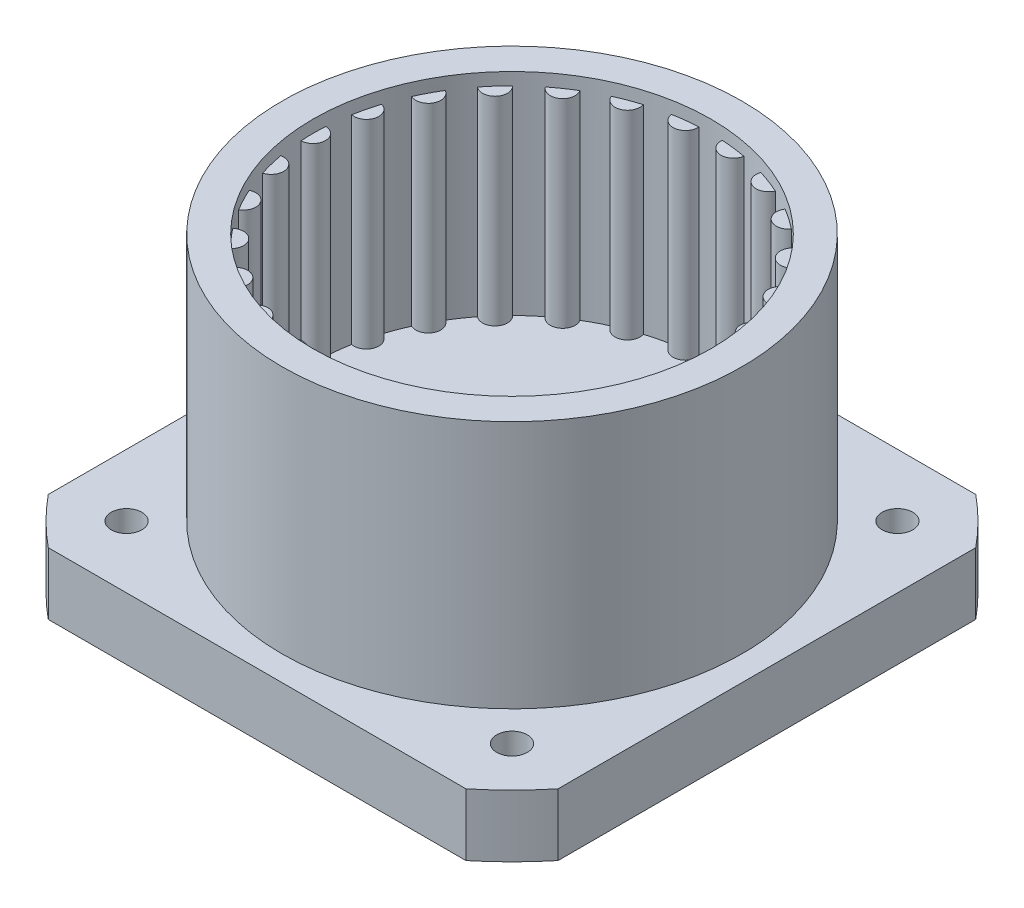
from build123d import *

# Parameters (mm, degrees)
BOSS_EXTRUDE1_DEPTH         = 8
BOSS_EXTRUDE1_DEPTH_BACK    = 8
SKETCH2_R                   = 1
BOSS_EXTRUDE1_2_DEPTH       = 8
BOSS_EXTRUDE1_2_DEPTH_BACK  = 8
BOSS_EXTRUDE1_3_DEPTH       = 8
BOSS_EXTRUDE1_3_DEPTH_BACK  = 8
BOSS_EXTRUDE1_4_DEPTH       = 8
BOSS_EXTRUDE1_4_DEPTH_BACK  = 8
BOSS_EXTRUDE1_5_DEPTH       = 8
BOSS_EXTRUDE1_5_DEPTH_BACK  = 8
BOSS_EXTRUDE1_6_DEPTH       = 8
BOSS_EXTRUDE1_6_DEPTH_BACK  = 8
BOSS_EXTRUDE1_7_DEPTH       = 8
BOSS_EXTRUDE1_7_DEPTH_BACK  = 8
BOSS_EXTRUDE1_8_DEPTH       = 8
BOSS_EXTRUDE1_8_DEPTH_BACK  = 8
BOSS_EXTRUDE1_9_DEPTH       = 8
BOSS_EXTRUDE1_9_DEPTH_BACK  = 8
BOSS_EXTRUDE1_10_DEPTH      = 8
BOSS_EXTRUDE1_10_DEPTH_BACK = 8
BOSS_EXTRUDE1_11_DEPTH      = 8
BOSS_EXTRUDE1_11_DEPTH_BACK = 8
BOSS_EXTRUDE1_12_DEPTH      = 8
BOSS_EXTRUDE1_12_DEPTH_BACK = 8
BOSS_EXTRUDE1_13_DEPTH      = 8
BOSS_EXTRUDE1_13_DEPTH_BACK = 8
BOSS_EXTRUDE1_14_DEPTH      = 8
BOSS_EXTRUDE1_14_DEPTH_BACK = 8
BOSS_EXTRUDE1_15_DEPTH      = 8
BOSS_EXTRUDE1_15_DEPTH_BACK = 8
BOSS_EXTRUDE1_16_DEPTH      = 8
BOSS_EXTRUDE1_16_DEPTH_BACK = 8
BOSS_EXTRUDE1_17_DEPTH      = 8
BOSS_EXTRUDE1_17_DEPTH_BACK = 8
BOSS_EXTRUDE1_18_DEPTH      = 8
BOSS_EXTRUDE1_18_DEPTH_BACK = 8
BOSS_EXTRUDE1_19_DEPTH      = 8
BOSS_EXTRUDE1_19_DEPTH_BACK = 8
BOSS_EXTRUDE1_20_DEPTH      = 8
BOSS_EXTRUDE1_20_DEPTH_BACK = 8
BOSS_EXTRUDE1_21_DEPTH      = 8
BOSS_EXTRUDE1_21_DEPTH_BACK = 8
BOSS_EXTRUDE1_22_DEPTH      = 8
BOSS_EXTRUDE1_22_DEPTH_BACK = 8
BOSS_EXTRUDE1_23_DEPTH      = 8
BOSS_EXTRUDE1_23_DEPTH_BACK = 8
BOSS_EXTRUDE1_24_DEPTH      = 8
BOSS_EXTRUDE1_24_DEPTH_BACK = 8
BOSS_EXTRUDE1_25_DEPTH      = 8
BOSS_EXTRUDE1_25_DEPTH_BACK = 8
BOSS_EXTRUDE1_26_DEPTH      = 8
BOSS_EXTRUDE1_26_DEPTH_BACK = 8
BOSS_EXTRUDE3_DEPTH         = 8
BOSS_EXTRUDE3_DEPTH_BACK    = 8
SKETCH5_R                   = 18.5
SKETCH5_R_2                 = 16
SKETCH6_R                   = 18.5
SKETCH6_R_2                 = 16
BOSS_EXTRUDE4_DEPTH         = 1
BOSS_EXTRUDE5_START         = 3
SKETCH8_R                   = 18.5
BOSS_EXTRUDE5_DEPTH         = 3
SKETCH9_R                   = 6
CUT_EXTRUDE1_DEPTH          = 3
BOSS_EXTRUDE7_START         = 5
SKETCH13_R                  = 1.23
SKETCH13_R_2                = 6
BOSS_EXTRUDE7_DEPTH         = 5


with BuildPart() as part:
    # Sketch2 → Boss-Extrude1 (new, two sides: drawn at the far end of the back side and taken through both)
    with BuildSketch(Plane(origin=(0, 0, 0), x_dir=(1, 0, 0), z_dir=(0, 1, 0)).offset(-BOSS_EXTRUDE1_DEPTH_BACK)):
        with Locations((15.5, 0)):
            Circle(SKETCH2_R)
    extrude(amount=BOSS_EXTRUDE1_DEPTH + BOSS_EXTRUDE1_DEPTH_BACK)



with BuildPart() as body_2:
    # Sketch2 → Boss-Extrude1 2 (new, two sides: drawn at the far end of the back side and taken through both)
    with BuildSketch(Plane(origin=(0, 0, 0), x_dir=(1, 0, 0), z_dir=(0, 1, 0)).offset(-BOSS_EXTRUDE1_2_DEPTH_BACK)):
        with Locations((15.035069079, -3.829050629)):
            Circle(SKETCH2_R)
    extrude(amount=BOSS_EXTRUDE1_2_DEPTH + BOSS_EXTRUDE1_2_DEPTH_BACK)


with BuildPart() as body_3:
    # Sketch2 → Boss-Extrude1 3 (new, two sides: drawn at the far end of the back side and taken through both)
    with BuildSketch(Plane(origin=(0, 0, 0), x_dir=(1, 0, 0), z_dir=(0, 1, 0)).offset(-BOSS_EXTRUDE1_3_DEPTH_BACK)):
        with Locations((13.66729641, -7.435570753)):
            Circle(SKETCH2_R)
    extrude(amount=BOSS_EXTRUDE1_3_DEPTH + BOSS_EXTRUDE1_3_DEPTH_BACK)


with BuildPart() as body_4:
    # Sketch2 → Boss-Extrude1 4 (new, two sides: drawn at the far end of the back side and taken through both)
    with BuildSketch(Plane(origin=(0, 0, 0), x_dir=(1, 0, 0), z_dir=(0, 1, 0)).offset(-BOSS_EXTRUDE1_4_DEPTH_BACK)):
        with Locations((11.476171971, -10.609962532)):
            Circle(SKETCH2_R)
    extrude(amount=BOSS_EXTRUDE1_4_DEPTH + BOSS_EXTRUDE1_4_DEPTH_BACK)


with BuildPart() as body_5:
    # Sketch2 → Boss-Extrude1 5 (new, two sides: drawn at the far end of the back side and taken through both)
    with BuildSketch(Plane(origin=(0, 0, 0), x_dir=(1, 0, 0), z_dir=(0, 1, 0)).offset(-BOSS_EXTRUDE1_5_DEPTH_BACK)):
        with Locations((8.589035948, -13.167741854)):
            Circle(SKETCH2_R)
    extrude(amount=BOSS_EXTRUDE1_5_DEPTH + BOSS_EXTRUDE1_5_DEPTH_BACK)


with BuildPart() as body_6:
    # Sketch2 → Boss-Extrude1 6 (new, two sides: drawn at the far end of the back side and taken through both)
    with BuildSketch(Plane(origin=(0, 0, 0), x_dir=(1, 0, 0), z_dir=(0, 1, 0)).offset(-BOSS_EXTRUDE1_6_DEPTH_BACK)):
        with Locations((5.173678193, -14.960259883)):
            Circle(SKETCH2_R)
    extrude(amount=BOSS_EXTRUDE1_6_DEPTH + BOSS_EXTRUDE1_6_DEPTH_BACK)


with BuildPart() as body_7:
    # Sketch2 → Boss-Extrude1 7 (new, two sides: drawn at the far end of the back side and taken through both)
    with BuildSketch(Plane(origin=(0, 0, 0), x_dir=(1, 0, 0), z_dir=(0, 1, 0)).offset(-BOSS_EXTRUDE1_7_DEPTH_BACK)):
        with Locations((1.428586884, -15.883341986)):
            Circle(SKETCH2_R)
    extrude(amount=BOSS_EXTRUDE1_7_DEPTH + BOSS_EXTRUDE1_7_DEPTH_BACK)


with BuildPart() as body_8:
    # Sketch2 → Boss-Extrude1 8 (new, two sides: drawn at the far end of the back side and taken through both)
    with BuildSketch(Plane(origin=(0, 0, 0), x_dir=(1, 0, 0), z_dir=(0, 1, 0)).offset(-BOSS_EXTRUDE1_8_DEPTH_BACK)):
        with Locations((-2.428586884, -15.883341986)):
            Circle(SKETCH2_R)
    extrude(amount=BOSS_EXTRUDE1_8_DEPTH + BOSS_EXTRUDE1_8_DEPTH_BACK)


with BuildPart() as body_9:
    # Sketch2 → Boss-Extrude1 9 (new, two sides: drawn at the far end of the back side and taken through both)
    with BuildSketch(Plane(origin=(0, 0, 0), x_dir=(1, 0, 0), z_dir=(0, 1, 0)).offset(-BOSS_EXTRUDE1_9_DEPTH_BACK)):
        with Locations((-6.173678193, -14.960259883)):
            Circle(SKETCH2_R)
    extrude(amount=BOSS_EXTRUDE1_9_DEPTH + BOSS_EXTRUDE1_9_DEPTH_BACK)


with BuildPart() as body_10:
    # Sketch2 → Boss-Extrude1 10 (new, two sides: drawn at the far end of the back side and taken through both)
    with BuildSketch(Plane(origin=(0, 0, 0), x_dir=(1, 0, 0), z_dir=(0, 1, 0)).offset(-BOSS_EXTRUDE1_10_DEPTH_BACK)):
        with Locations((-9.589035948, -13.167741854)):
            Circle(SKETCH2_R)
    extrude(amount=BOSS_EXTRUDE1_10_DEPTH + BOSS_EXTRUDE1_10_DEPTH_BACK)


with BuildPart() as body_11:
    # Sketch2 → Boss-Extrude1 11 (new, two sides: drawn at the far end of the back side and taken through both)
    with BuildSketch(Plane(origin=(0, 0, 0), x_dir=(1, 0, 0), z_dir=(0, 1, 0)).offset(-BOSS_EXTRUDE1_11_DEPTH_BACK)):
        with Locations((-12.476171971, -10.609962532)):
            Circle(SKETCH2_R)
    extrude(amount=BOSS_EXTRUDE1_11_DEPTH + BOSS_EXTRUDE1_11_DEPTH_BACK)


with BuildPart() as body_12:
    # Sketch2 → Boss-Extrude1 12 (new, two sides: drawn at the far end of the back side and taken through both)
    with BuildSketch(Plane(origin=(0, 0, 0), x_dir=(1, 0, 0), z_dir=(0, 1, 0)).offset(-BOSS_EXTRUDE1_12_DEPTH_BACK)):
        with Locations((-14.66729641, -7.435570753)):
            Circle(SKETCH2_R)
    extrude(amount=BOSS_EXTRUDE1_12_DEPTH + BOSS_EXTRUDE1_12_DEPTH_BACK)


with BuildPart() as body_13:
    # Sketch2 → Boss-Extrude1 13 (new, two sides: drawn at the far end of the back side and taken through both)
    with BuildSketch(Plane(origin=(0, 0, 0), x_dir=(1, 0, 0), z_dir=(0, 1, 0)).offset(-BOSS_EXTRUDE1_13_DEPTH_BACK)):
        with Locations((-16.035069079, -3.829050629)):
            Circle(SKETCH2_R)
    extrude(amount=BOSS_EXTRUDE1_13_DEPTH + BOSS_EXTRUDE1_13_DEPTH_BACK)


with BuildPart() as body_14:
    # Sketch2 → Boss-Extrude1 14 (new, two sides: drawn at the far end of the back side and taken through both)
    with BuildSketch(Plane(origin=(0, 0, 0), x_dir=(1, 0, 0), z_dir=(0, 1, 0)).offset(-BOSS_EXTRUDE1_14_DEPTH_BACK)):
        with Locations((-16.5, 0)):
            Circle(SKETCH2_R)
    extrude(amount=BOSS_EXTRUDE1_14_DEPTH + BOSS_EXTRUDE1_14_DEPTH_BACK)


with BuildPart() as body_15:
    # Sketch2 → Boss-Extrude1 15 (new, two sides: drawn at the far end of the back side and taken through both)
    with BuildSketch(Plane(origin=(0, 0, 0), x_dir=(1, 0, 0), z_dir=(0, 1, 0)).offset(-BOSS_EXTRUDE1_15_DEPTH_BACK)):
        with Locations((-16.035069079, 3.829050629)):
            Circle(SKETCH2_R)
    extrude(amount=BOSS_EXTRUDE1_15_DEPTH + BOSS_EXTRUDE1_15_DEPTH_BACK)


with BuildPart() as body_16:
    # Sketch2 → Boss-Extrude1 16 (new, two sides: drawn at the far end of the back side and taken through both)
    with BuildSketch(Plane(origin=(0, 0, 0), x_dir=(1, 0, 0), z_dir=(0, 1, 0)).offset(-BOSS_EXTRUDE1_16_DEPTH_BACK)):
        with Locations((-14.66729641, 7.435570753)):
            Circle(SKETCH2_R)
    extrude(amount=BOSS_EXTRUDE1_16_DEPTH + BOSS_EXTRUDE1_16_DEPTH_BACK)


with BuildPart() as body_17:
    # Sketch2 → Boss-Extrude1 17 (new, two sides: drawn at the far end of the back side and taken through both)
    with BuildSketch(Plane(origin=(0, 0, 0), x_dir=(1, 0, 0), z_dir=(0, 1, 0)).offset(-BOSS_EXTRUDE1_17_DEPTH_BACK)):
        with Locations((-12.476171971, 10.609962532)):
            Circle(SKETCH2_R)
    extrude(amount=BOSS_EXTRUDE1_17_DEPTH + BOSS_EXTRUDE1_17_DEPTH_BACK)


with BuildPart() as body_18:
    # Sketch2 → Boss-Extrude1 18 (new, two sides: drawn at the far end of the back side and taken through both)
    with BuildSketch(Plane(origin=(0, 0, 0), x_dir=(1, 0, 0), z_dir=(0, 1, 0)).offset(-BOSS_EXTRUDE1_18_DEPTH_BACK)):
        with Locations((-9.589035948, 13.167741854)):
            Circle(SKETCH2_R)
    extrude(amount=BOSS_EXTRUDE1_18_DEPTH + BOSS_EXTRUDE1_18_DEPTH_BACK)


with BuildPart() as body_19:
    # Sketch2 → Boss-Extrude1 19 (new, two sides: drawn at the far end of the back side and taken through both)
    with BuildSketch(Plane(origin=(0, 0, 0), x_dir=(1, 0, 0), z_dir=(0, 1, 0)).offset(-BOSS_EXTRUDE1_19_DEPTH_BACK)):
        with Locations((-6.173678193, 14.960259883)):
            Circle(SKETCH2_R)
    extrude(amount=BOSS_EXTRUDE1_19_DEPTH + BOSS_EXTRUDE1_19_DEPTH_BACK)


with BuildPart() as body_20:
    # Sketch2 → Boss-Extrude1 20 (new, two sides: drawn at the far end of the back side and taken through both)
    with BuildSketch(Plane(origin=(0, 0, 0), x_dir=(1, 0, 0), z_dir=(0, 1, 0)).offset(-BOSS_EXTRUDE1_20_DEPTH_BACK)):
        with Locations((-2.428586884, 15.883341986)):
            Circle(SKETCH2_R)
    extrude(amount=BOSS_EXTRUDE1_20_DEPTH + BOSS_EXTRUDE1_20_DEPTH_BACK)


with BuildPart() as body_21:
    # Sketch2 → Boss-Extrude1 21 (new, two sides: drawn at the far end of the back side and taken through both)
    with BuildSketch(Plane(origin=(0, 0, 0), x_dir=(1, 0, 0), z_dir=(0, 1, 0)).offset(-BOSS_EXTRUDE1_21_DEPTH_BACK)):
        with Locations((1.428586884, 15.883341986)):
            Circle(SKETCH2_R)
    extrude(amount=BOSS_EXTRUDE1_21_DEPTH + BOSS_EXTRUDE1_21_DEPTH_BACK)


with BuildPart() as body_22:
    # Sketch2 → Boss-Extrude1 22 (new, two sides: drawn at the far end of the back side and taken through both)
    with BuildSketch(Plane(origin=(0, 0, 0), x_dir=(1, 0, 0), z_dir=(0, 1, 0)).offset(-BOSS_EXTRUDE1_22_DEPTH_BACK)):
        with Locations((5.173678193, 14.960259883)):
            Circle(SKETCH2_R)
    extrude(amount=BOSS_EXTRUDE1_22_DEPTH + BOSS_EXTRUDE1_22_DEPTH_BACK)


with BuildPart() as body_23:
    # Sketch2 → Boss-Extrude1 23 (new, two sides: drawn at the far end of the back side and taken through both)
    with BuildSketch(Plane(origin=(0, 0, 0), x_dir=(1, 0, 0), z_dir=(0, 1, 0)).offset(-BOSS_EXTRUDE1_23_DEPTH_BACK)):
        with Locations((8.589035948, 13.167741854)):
            Circle(SKETCH2_R)
    extrude(amount=BOSS_EXTRUDE1_23_DEPTH + BOSS_EXTRUDE1_23_DEPTH_BACK)


with BuildPart() as body_24:
    # Sketch2 → Boss-Extrude1 24 (new, two sides: drawn at the far end of the back side and taken through both)
    with BuildSketch(Plane(origin=(0, 0, 0), x_dir=(1, 0, 0), z_dir=(0, 1, 0)).offset(-BOSS_EXTRUDE1_24_DEPTH_BACK)):
        with Locations((11.476171971, 10.609962532)):
            Circle(SKETCH2_R)
    extrude(amount=BOSS_EXTRUDE1_24_DEPTH + BOSS_EXTRUDE1_24_DEPTH_BACK)


with BuildPart() as body_25:
    # Sketch2 → Boss-Extrude1 25 (new, two sides: drawn at the far end of the back side and taken through both)
    with BuildSketch(Plane(origin=(0, 0, 0), x_dir=(1, 0, 0), z_dir=(0, 1, 0)).offset(-BOSS_EXTRUDE1_25_DEPTH_BACK)):
        with Locations((13.66729641, 7.435570753)):
            Circle(SKETCH2_R)
    extrude(amount=BOSS_EXTRUDE1_25_DEPTH + BOSS_EXTRUDE1_25_DEPTH_BACK)


with BuildPart() as body_26:
    # Sketch2 → Boss-Extrude1 26 (new, two sides: drawn at the far end of the back side and taken through both)
    with BuildSketch(Plane(origin=(0, 0, 0), x_dir=(1, 0, 0), z_dir=(0, 1, 0)).offset(-BOSS_EXTRUDE1_26_DEPTH_BACK)):
        with Locations((15.035069079, 3.829050629)):
            Circle(SKETCH2_R)
    extrude(amount=BOSS_EXTRUDE1_26_DEPTH + BOSS_EXTRUDE1_26_DEPTH_BACK)


with BuildPart() as part_1:
    add(part.part)

    add(body_2.part)  # Boss-Extrude3 merges body 2

    add(body_3.part)  # Boss-Extrude3 merges body 3

    add(body_4.part)  # Boss-Extrude3 merges body 4

    add(body_5.part)  # Boss-Extrude3 merges body 5

    add(body_6.part)  # Boss-Extrude3 merges body 6

    add(body_7.part)  # Boss-Extrude3 merges body 7

    add(body_8.part)  # Boss-Extrude3 merges body 8

    add(body_9.part)  # Boss-Extrude3 merges body 9

    add(body_10.part)  # Boss-Extrude3 merges body 10

    add(body_11.part)  # Boss-Extrude3 merges body 11

    add(body_12.part)  # Boss-Extrude3 merges body 12

    add(body_13.part)  # Boss-Extrude3 merges body 13

    add(body_14.part)  # Boss-Extrude3 merges body 14

    add(body_15.part)  # Boss-Extrude3 merges body 15

    add(body_16.part)  # Boss-Extrude3 merges body 16

    add(body_17.part)  # Boss-Extrude3 merges body 17

    add(body_18.part)  # Boss-Extrude3 merges body 18

    add(body_19.part)  # Boss-Extrude3 merges body 19

    add(body_20.part)  # Boss-Extrude3 merges body 20

    add(body_21.part)  # Boss-Extrude3 merges body 21

    add(body_22.part)  # Boss-Extrude3 merges body 22

    add(body_23.part)  # Boss-Extrude3 merges body 23

    add(body_24.part)  # Boss-Extrude3 merges body 24

    add(body_25.part)  # Boss-Extrude3 merges body 25

    add(body_26.part)  # Boss-Extrude3 merges body 26
    # Sketch5 → Boss-Extrude3 (add, two sides: drawn at the far end of the back side and taken through both)
    with BuildSketch(Plane(origin=(0, 0, 0), x_dir=(1, 0, 0), z_dir=(0, 1, 0)).offset(-BOSS_EXTRUDE3_DEPTH_BACK)):
        with Locations((-0.5, 0)):
            Circle(SKETCH5_R)
        with Locations((-0.5, 0)):
            Circle(SKETCH5_R_2, mode=Mode.SUBTRACT)
    extrude(amount=BOSS_EXTRUDE3_DEPTH + BOSS_EXTRUDE3_DEPTH_BACK)

    # Sketch6 → Boss-Extrude4 (add)
    with BuildSketch(Plane(origin=(0, 8, 0), x_dir=(1, 0, 0), z_dir=(0, 1, 0))):
        with Locations((-0.5, 0)):
            Circle(SKETCH6_R)
        with Locations((-0.5, 0)):
            Circle(SKETCH6_R_2, mode=Mode.SUBTRACT)
    extrude(amount=BOSS_EXTRUDE4_DEPTH)

    # Sketch8 → Boss-Extrude5 (add)
    with BuildSketch(Plane.XZ.offset(8).offset(BOSS_EXTRUDE5_START)):
        with Locations((-0.5, 0)):
            Circle(SKETCH8_R)
    extrude(amount=-BOSS_EXTRUDE5_DEPTH)

    # Sketch9 → Cut-Extrude1 (cut)
    with BuildSketch(Plane.XZ.offset(11)):
        with Locations((-0.5, 0)):
            Circle(SKETCH9_R)
    extrude(amount=-CUT_EXTRUDE1_DEPTH, mode=Mode.SUBTRACT)

    # Sketch13 → Boss-Extrude7 (add)
    with BuildSketch(Plane.XZ.offset(11).offset(BOSS_EXTRUDE7_START)):
        with BuildLine():
            Line((-17.292855624, -20.5), (16.292855624, -20.5))
            ThreePointArc((16.292855624, -20.5), (18.238329701, -18.738329701), (20, -16.792855624))
            Line((20, -16.792855624), (20, 16.792855624))
            ThreePointArc((20, 16.792855624), (18.238329701, 18.738329701), (16.292855624, 20.5))
            Line((16.292855624, 20.5), (-17.292855624, 20.5))
            ThreePointArc((-17.292855624, 20.5), (-19.238329701, 18.738329701), (-21, 16.792855624))
            Line((-21, 16.792855624), (-21, -16.792855624))
            ThreePointArc((-21, -16.792855624), (-19.238329701, -18.738329701), (-17.292855624, -20.5))
        make_face()
        with Locations((-16, -15.5)):
            Circle(SKETCH13_R, mode=Mode.SUBTRACT)
        with Locations((15, -15.5)):
            Circle(SKETCH13_R, mode=Mode.SUBTRACT)
        with Locations((15, 15.5)):
            Circle(SKETCH13_R, mode=Mode.SUBTRACT)
        with Locations((-16, 15.5)):
            Circle(SKETCH13_R, mode=Mode.SUBTRACT)
        with Locations((-0.5, 0)):
            Circle(SKETCH13_R_2, mode=Mode.SUBTRACT)
    extrude(amount=-BOSS_EXTRUDE7_DEPTH)


solid = part_1.part
